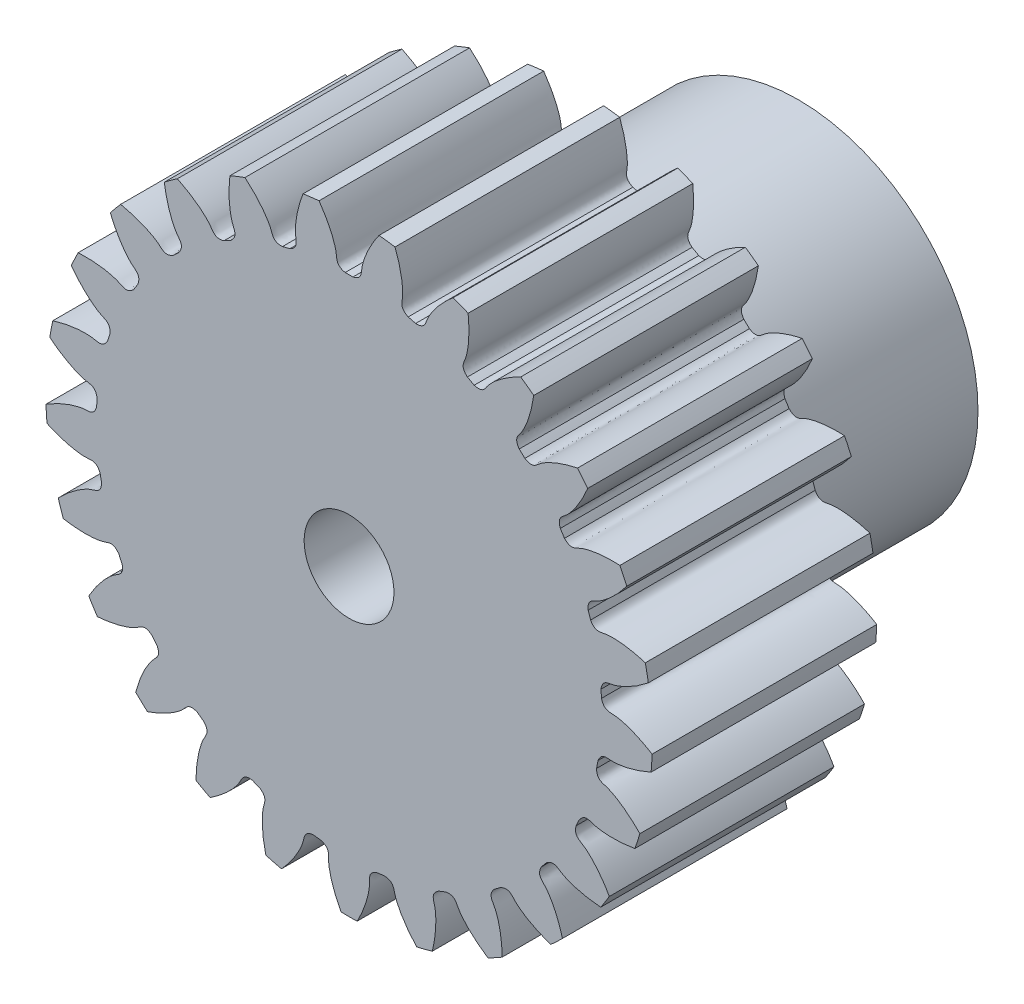
from build123d import *

# Parameters (mm, degrees)
SKETCH_1_R               = 6.75
EXTRUDE_1_DEPTH          = 5
CUT_EXTRUDE_1_DEPTH      = 11.776131031
PATTERN_CIRCULAR_1_COUNT = 25
SKETCH_6_R               = 4
EXTRUDE_2_DEPTH          = 5
SKETCH_7_R               = 1
CUT_EXTRUDE_3_DEPTH      = 16


with BuildPart() as part:
    # 草图1 → 凸台-拉伸1 (new body)
    with BuildSketch(Plane.XY):
        Circle(SKETCH_1_R)
    extrude(amount=EXTRUDE_1_DEPTH)

    # 草图2 → 切除-拉伸1 (cut, through all)
    with BuildSketch(Plane.XY):
        with BuildLine():
            ThreePointArc((0.086029244, 5.624342092), (0, 5.625), (-0.086029244, 5.624342092))
            add(Edge.make_bspline(
                [(-0.086029244, 5.624342092), (-0.286669906, 5.667540581), (-0.267753818, 5.788630697), (-0.287097693, 5.909026378), (-0.289810636, 5.924054221), (-0.293288215, 5.941327762), (-0.297617759, 5.960822225), (-0.302890392, 5.982509291), (-0.309194965, 6.006358199), (-0.316619923, 6.032335416), (-0.325252622, 6.060404775), (-0.335179446, 6.090527458), (-0.346485678, 6.122662039), (-0.359255446, 6.156764509), (-0.373571655, 6.192788302), (-0.389515913, 6.230684333), (-0.407168466, 6.270401027), (-0.426608131, 6.311884356), (-0.447912232, 6.355077874), (-0.471156531, 6.399922761), (-0.496415167, 6.446357855), (-0.523760595, 6.4943197), (-0.553263516, 6.543742587), (-0.584992825, 6.594558599), (-0.619015546, 6.646697658), (-0.655396777, 6.700087572), (-0.694199626, 6.754654086), (-0.735485164, 6.81032093), (-0.77931236, 6.867009875), (-0.825738035, 6.924640784), (-0.874816806, 6.983131666), (-0.926601035, 7.042398738), (-0.981140781, 7.102356476), (-1.038483749, 7.162917676), (-1.098675245, 7.223993519), (-1.161758131, 7.285493625), (-1.227772777, 7.347326118), (-1.29675703, 7.409397694), (-1.368746143, 7.471613679), (-1.469986972, 7.555633137), (-1.548733275, 7.617046576), (-1.602635738, 7.657417086)],
                knots=[0, 0, 0, 0, 0.130741207, 0.13574479, 0.141658115, 0.148481183, 0.156213993, 0.164856545, 0.174408839, 0.184870876, 0.196242655, 0.208524177, 0.221715441, 0.235816447, 0.250827195, 0.266747686, 0.283577919, 0.301317894, 0.319967612, 0.339527072, 0.359996274, 0.381375219, 0.403663906, 0.426862335, 0.450970507, 0.475988421, 0.501916077, 0.528753476, 0.556500617, 0.5851575, 0.614724126, 0.645200493, 0.676586604, 0.708882456, 0.742088051, 0.776203388, 0.811228468, 0.847163289, 0.884007854, 0.92176216, 1, 1, 1, 1], degree=3))
            ThreePointArc((-1.602635738, 7.657417086), (0, 7.82332907), (1.602635738, 7.657417086))
            add(Edge.make_bspline(
                [(0.086029244, 5.624342092), (0.286669906, 5.667540581), (0.267753818, 5.788630697), (0.287097693, 5.909026378), (0.289810636, 5.924054221), (0.293288215, 5.941327762), (0.297617759, 5.960822225), (0.302890392, 5.982509291), (0.309194965, 6.006358199), (0.316619923, 6.032335416), (0.325252622, 6.060404775), (0.335179446, 6.090527458), (0.346485678, 6.122662039), (0.359255446, 6.156764509), (0.373571655, 6.192788302), (0.389515913, 6.230684333), (0.407168466, 6.270401027), (0.426608131, 6.311884356), (0.447912232, 6.355077874), (0.471156531, 6.399922761), (0.496415167, 6.446357855), (0.523760595, 6.4943197), (0.553263516, 6.543742587), (0.584992825, 6.594558599), (0.619015546, 6.646697658), (0.655396777, 6.700087572), (0.694199626, 6.754654086), (0.735485164, 6.81032093), (0.77931236, 6.867009875), (0.825738035, 6.924640784), (0.874816806, 6.983131666), (0.926601035, 7.042398738), (0.981140781, 7.102356476), (1.038483749, 7.162917676), (1.098675245, 7.223993519), (1.161758131, 7.285493625), (1.227772777, 7.347326118), (1.29675703, 7.409397694), (1.368746143, 7.471613679), (1.469986972, 7.555633137), (1.548733275, 7.617046576), (1.602635738, 7.657417086)],
                knots=[0, 0, 0, 0, 0.130741207, 0.13574479, 0.141658115, 0.148481183, 0.156213993, 0.164856545, 0.174408839, 0.184870876, 0.196242655, 0.208524177, 0.221715441, 0.235816447, 0.250827195, 0.266747686, 0.283577919, 0.301317894, 0.319967612, 0.339527072, 0.359996274, 0.381375219, 0.403663906, 0.426862335, 0.450970507, 0.475988421, 0.501916077, 0.528753476, 0.556500617, 0.5851575, 0.614724126, 0.645200493, 0.676586604, 0.708882456, 0.742088051, 0.776203388, 0.811228468, 0.847163289, 0.884007854, 0.92176216, 1, 1, 1, 1], degree=3))
        make_face()
    cut_extrude_1 = extrude(amount=CUT_EXTRUDE_1_DEPTH, mode=Mode.SUBTRACT)

    # 阵列(圆周)1: 切除-拉伸1 ×25 about axis
    pattern_circular_1_axis = Axis((0, 0, 5), (0, 0, -1))
    for i in range(1, PATTERN_CIRCULAR_1_COUNT):
        add(cut_extrude_1.rotate(pattern_circular_1_axis, i * 360 / PATTERN_CIRCULAR_1_COUNT), mode=Mode.SUBTRACT)

    # 草图6 → 凸台-拉伸2 (add)
    with BuildSketch(Plane(origin=(0, 0, 0), x_dir=(-1, 0, 0), z_dir=(0, 0, -1))):
        Circle(SKETCH_6_R)
    extrude(amount=EXTRUDE_2_DEPTH)

    # 草图7 → 切除-拉伸3 (cut)
    with BuildSketch(Plane(origin=(0, 0, -5), x_dir=(-1, 0, 0), z_dir=(0, 0, -1))):
        Circle(SKETCH_7_R)
    extrude(amount=-CUT_EXTRUDE_3_DEPTH, mode=Mode.SUBTRACT)


solid = part.part
